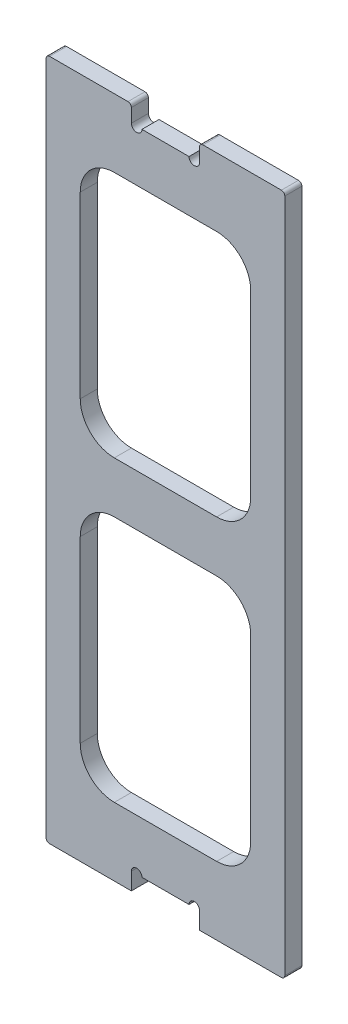
from build123d import *

# Parameters (mm, degrees)
SKETCH_1_W          = 25
SKETCH_1_H          = 5
SKETCH_1_W_2        = 70
SKETCH_1_H_2        = 190
EXTRUDE_1_DEPTH     = 5
SKETCH_2_R          = 1.55
CUT_EXTRUDE_1_DEPTH = 5
SKETCH_3_W          = 50
SKETCH_3_H          = 72.5
CUT_EXTRUDE_2_DEPTH = 5
FILLET_1_R          = 10
FILLET_2_R          = 1


with BuildPart() as part:
    # 草图1 → 凸台-拉伸1 (new body)
    with BuildSketch(Plane.XY):
        with Locations((57.5, 192.5)):
            Rectangle(SKETCH_1_W, SKETCH_1_H)
        with Locations((35, 95)):
            Rectangle(SKETCH_1_W_2, SKETCH_1_H_2)
        with Locations((12.5, 192.5)):
            Rectangle(SKETCH_1_W, SKETCH_1_H)
        with Locations((57.5, -2.5)):
            Rectangle(SKETCH_1_W, SKETCH_1_H)
        with Locations((12.5, -2.5)):
            Rectangle(SKETCH_1_W, SKETCH_1_H)
    extrude(amount=EXTRUDE_1_DEPTH)

    # 草图2 → 切除-拉伸1 (cut)
    with BuildSketch(Plane.XY.offset(5)):
        with Locations((43.45, 0)):
            Circle(SKETCH_2_R)
        with Locations((26.55, 0)):
            Circle(SKETCH_2_R)
        with Locations((43.45, 190)):
            Circle(SKETCH_2_R)
        with Locations((26.55, 190)):
            Circle(SKETCH_2_R)
    extrude(amount=-CUT_EXTRUDE_1_DEPTH, mode=Mode.SUBTRACT)

    # 草图3 → 切除-拉伸2 (cut)
    with BuildSketch(Plane.XY.offset(5)):
        with Locations((35, 51.25)):
            Rectangle(SKETCH_3_W, SKETCH_3_H)
        with Locations((35, 138.75)):
            Rectangle(SKETCH_3_W, SKETCH_3_H)
    extrude(amount=-CUT_EXTRUDE_2_DEPTH, mode=Mode.SUBTRACT)

    # 圆角1
    fillet_1_edges = [part.edges().sort_by_distance(p)[0] for p in [
        (10, 15, 2.5),
        (10, 87.5, 2.5),
        (60, 87.5, 2.5),
        (60, 15, 2.5),
        (10, 102.5, 2.5),
        (10, 175, 2.5),
        (60, 175, 2.5),
        (60, 102.5, 2.5),
    ]]
    fillet(fillet_1_edges, radius=FILLET_1_R)

    # 圆角2
    fillet_2_edges = [part.edges().sort_by_distance(p)[0] for p in [
        (45, 195, 2.5),
        (70, 195, 2.5),
        (70, -5, 2.5),
        (0, -5, 2.5),
        (0, 195, 2.5),
        (25, 195, 2.5),
    ]]
    fillet(fillet_2_edges, radius=FILLET_2_R)


solid = part.part
